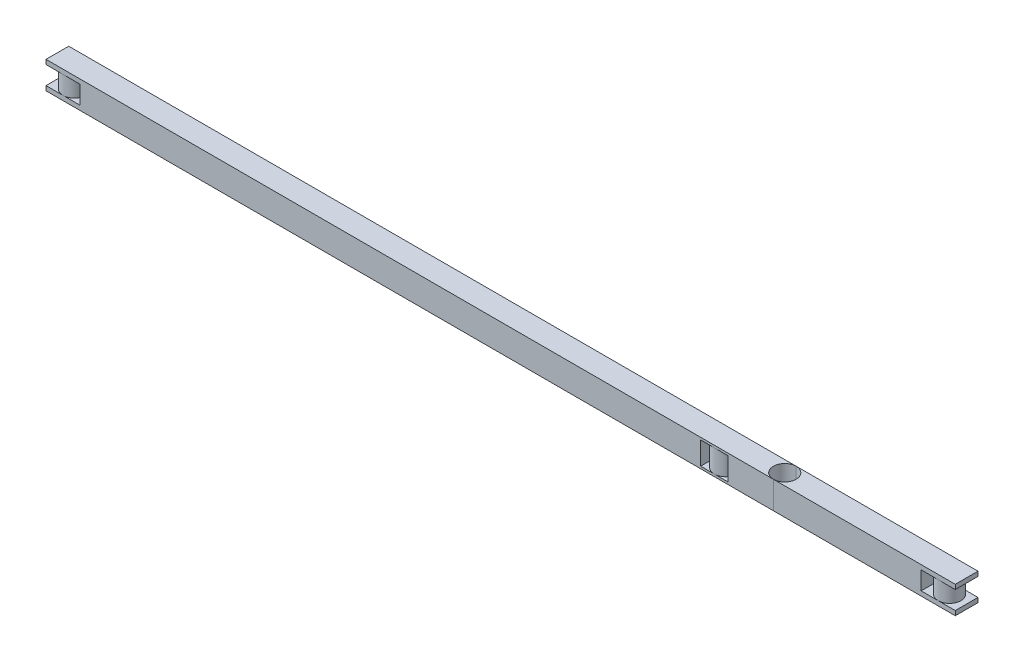
from build123d import *

# Parameters (mm, degrees)
BOSS_EXTRUDE1_DEPTH = 5
SKETCH2_R           = 2.5
BOSS_EXTRUDE2_DEPTH = 5
SKETCH4_R           = 2.5
BOSS_EXTRUDE3_DEPTH = 5
SKETCH8_W           = 6
SKETCH8_H           = 6
CUT_EXTRUDE9_DEPTH  = 2.5
BOSS_EXTRUDE4_REACH = 202.138
SKETCH9_R           = 2.5
SKETCH10_R          = 2.5
CUT_EXTRUDE10_DEPTH = 201.152441904


with BuildPart() as part:
    # Sketch1 → Boss-Extrude1 (new body)
    with BuildSketch(Plane.XY):
        Polygon((200, 0), (0, 0), (0, -1), (7.5, -1), (7.5, -5), (0, -5), (0, -6), (200, -6), (200, -5), (192.5, -5), (192.5, -1), (200, -1), align=None)
    extrude(amount=BOSS_EXTRUDE1_DEPTH)

    # Sketch2 → Boss-Extrude2 (add)
    with BuildSketch(Plane.XZ.offset(6)):
        with Locations(Location((3.75, 2.5, 0), (0, 0, 270))):
            Circle(SKETCH2_R)
    extrude(amount=-BOSS_EXTRUDE2_DEPTH)

    # Sketch4 → Boss-Extrude3 (add)
    with BuildSketch(Plane(origin=(0, 0, 0), x_dir=(1, 0, 0), z_dir=(0, 1, 0))):
        with Locations(Location((196.25, -2.5, 0), (0, 0, 270))):
            Circle(SKETCH4_R)
    extrude(amount=-BOSS_EXTRUDE3_DEPTH)

    # Sketch8 → Cut-Extrude9 (cut, symmetric)
    with BuildSketch(Plane(origin=(0, -3, 0), x_dir=(1, 0, 0), z_dir=(0, 1, 0))):
        with Locations((147, -3)):
            Rectangle(SKETCH8_W, SKETCH8_H)
    extrude(amount=CUT_EXTRUDE9_DEPTH, both=True, mode=Mode.SUBTRACT)

    # Sketch9 → Boss-Extrude4 (add, up to next)
    with BuildSketch(Plane(origin=(0, -5.5, 0), x_dir=(1, 0, 0), z_dir=(0, 1, 0)), mode=Mode.PRIVATE) as boss_extrude4_sk1:
        with Locations(Location((147, -2.5, 0), (0, 0, 90))):
            Circle(SKETCH9_R)
    boss_extrude4_tool1 = extrude(boss_extrude4_sk1.sketch, amount=BOSS_EXTRUDE4_REACH, mode=Mode.PRIVATE) - part.part
    add(boss_extrude4_tool1.solids().sort_by_distance((147, -5.5, 2.5))[0])

    # Sketch10 → Cut-Extrude10 (cut, through all)
    with BuildSketch(Plane(origin=(0, 0, 0), x_dir=(1, 0, 0), z_dir=(0, 1, 0))):
        with Locations((160, -2.5)):
            Circle(SKETCH10_R)
    extrude(amount=-CUT_EXTRUDE10_DEPTH, mode=Mode.SUBTRACT)


with BuildPart() as cut_extrude10_piece_1:
    # of the separate pieces the step leaves, piece 1, a body of its own (cut_extrude10_pieces)
    add(part.part.solids().sort_by_distance((0, -6, 0))[0])


with BuildPart() as cut_extrude10_piece_2:
    # of the separate pieces the step leaves, piece 2, a body of its own (cut_extrude10_pieces)
    add(part.part.solids().sort_by_distance((200, 0, 0))[0])


solid = Compound([cut_extrude10_piece_1.part, cut_extrude10_piece_2.part])
